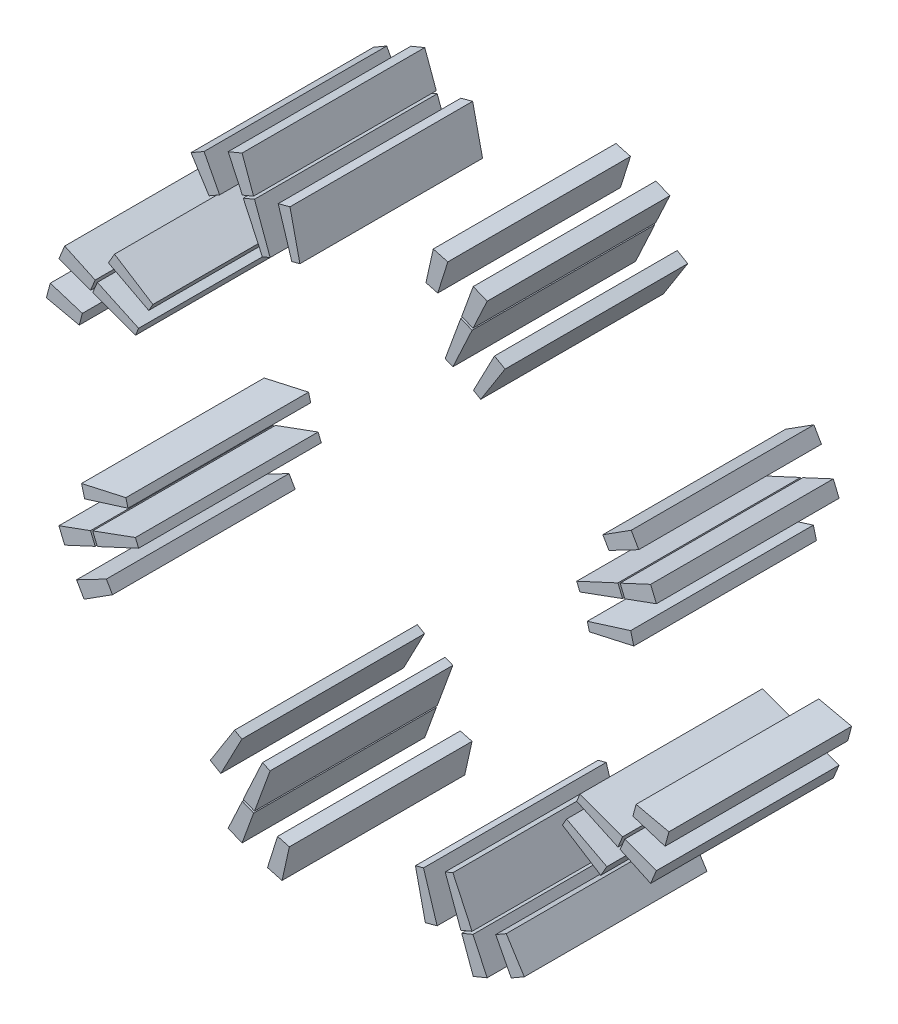
from build123d import *

# Parameters (mm, degrees)
SLOT_COPPER_ENVELOPES_START    = -15
SLOT_COPPER_ENVELOPES_DEPTH    = 30
SLOT_COPPER_ENVELOPES_2_DEPTH  = 30
SLOT_COPPER_ENVELOPES_3_DEPTH  = 30
SLOT_COPPER_ENVELOPES_4_DEPTH  = 30
SLOT_COPPER_ENVELOPES_5_DEPTH  = 30
SLOT_COPPER_ENVELOPES_6_DEPTH  = 30
SLOT_COPPER_ENVELOPES_7_DEPTH  = 30
SLOT_COPPER_ENVELOPES_8_DEPTH  = 30
SLOT_COPPER_ENVELOPES_9_DEPTH  = 30
SLOT_COPPER_ENVELOPES_10_DEPTH = 30
SLOT_COPPER_ENVELOPES_11_DEPTH = 30
SLOT_COPPER_ENVELOPES_12_DEPTH = 30
SLOT_COPPER_ENVELOPES_13_DEPTH = 30
SLOT_COPPER_ENVELOPES_14_DEPTH = 30
SLOT_COPPER_ENVELOPES_15_DEPTH = 30
SLOT_COPPER_ENVELOPES_16_DEPTH = 30
SLOT_COPPER_ENVELOPES_17_DEPTH = 30
SLOT_COPPER_ENVELOPES_18_DEPTH = 30
SLOT_COPPER_ENVELOPES_19_DEPTH = 30
SLOT_COPPER_ENVELOPES_20_DEPTH = 30
SLOT_COPPER_ENVELOPES_21_DEPTH = 30
SLOT_COPPER_ENVELOPES_22_DEPTH = 30
SLOT_COPPER_ENVELOPES_23_DEPTH = 30
SLOT_COPPER_ENVELOPES_24_DEPTH = 30
SLOT_COPPER_ENVELOPES_25_DEPTH = 30
SLOT_COPPER_ENVELOPES_26_DEPTH = 30
SLOT_COPPER_ENVELOPES_27_DEPTH = 30
SLOT_COPPER_ENVELOPES_28_DEPTH = 30
SLOT_COPPER_ENVELOPES_29_DEPTH = 30
SLOT_COPPER_ENVELOPES_30_DEPTH = 30
SLOT_COPPER_ENVELOPES_31_DEPTH = 30
SLOT_COPPER_ENVELOPES_32_DEPTH = 30


with BuildPart() as part:
    # Эскиз1 → Slot_copper_envelopes (new body)
    with BuildSketch(Plane.XY.offset(SLOT_COPPER_ENVELOPES_START)):
        Polygon((38.058700706, 9.486045745), (45.345480219, 11.114145895), (44.827410764, 13.047607424), (37.702824519, 10.814193756), align=None)
    extrude(amount=SLOT_COPPER_ENVELOPES_DEPTH)


with BuildPart() as body_2:
    # Эскиз1 → Slot_copper_envelopes 2 (new body)
    with BuildSketch(Plane.XY.offset(SLOT_COPPER_ENVELOPES_START)):
        Polygon((43.866578102, 17.086837391), (49.055420626, 18.979960184), (48.108279131, 21.266562026), (43.100573431, 18.936136255), align=None)
    extrude(amount=SLOT_COPPER_ENVELOPES_2_DEPTH)


with BuildPart() as body_3:
    # Эскиз1 → Slot_copper_envelopes 3 (new body)
    with BuildSketch(Plane.XY.offset(SLOT_COPPER_ENVELOPES_START)):
        Polygon((36.494925815, 14.372548593), (43.506856207, 16.937835703), (42.740851536, 18.787134567), (35.968736096, 15.64288295), align=None)
    extrude(amount=SLOT_COPPER_ENVELOPES_3_DEPTH)


with BuildPart() as body_4:
    # Эскиз1 → Slot_copper_envelopes 4 (new body)
    with BuildSketch(Plane.XY.offset(SLOT_COPPER_ENVELOPES_START)):
        Polygon((41.261013623, 22.666394534), (46.158362771, 25.220601255), (44.920862771, 27.364014129), (40.26018029, 24.399888717), align=None)
    extrude(amount=SLOT_COPPER_ENVELOPES_4_DEPTH)


with BuildPart() as body_5:
    # Эскиз1 → Slot_copper_envelopes 5 (new body)
    with BuildSketch(Plane.XY.offset(SLOT_COPPER_ENVELOPES_START)):
        Polygon((20.203918079, 33.619212625), (24.20520863, 39.922984488), (22.471714447, 40.923817822), (19.013133149, 34.306712625), align=None)
    extrude(amount=SLOT_COPPER_ENVELOPES_5_DEPTH)


with BuildPart() as body_6:
    # Эскиз1 → Slot_copper_envelopes 6 (new body)
    with BuildSketch(Plane.XY.offset(SLOT_COPPER_ENVELOPES_START)):
        Polygon((18.936136255, 43.100573431), (21.266562026, 48.108279131), (18.979960184, 49.055420626), (17.086837391, 43.866578102), align=None)
    extrude(amount=SLOT_COPPER_ENVELOPES_6_DEPTH)


with BuildPart() as body_7:
    # Эскиз1 → Slot_copper_envelopes 7 (new body)
    with BuildSketch(Plane.XY.offset(SLOT_COPPER_ENVELOPES_START)):
        Polygon((15.64288295, 35.968736096), (18.787134567, 42.740851536), (16.937835703, 43.506856207), (14.372548593, 36.494925815), align=None)
    extrude(amount=SLOT_COPPER_ENVELOPES_7_DEPTH)


with BuildPart() as body_8:
    # Эскиз1 → Slot_copper_envelopes 8 (new body)
    with BuildSketch(Plane.XY.offset(SLOT_COPPER_ENVELOPES_START)):
        Polygon((13.148381252, 45.203503812), (14.805233151, 50.472549497), (12.414566731, 51.113126634), (11.214919723, 45.721573267), align=None)
    extrude(amount=SLOT_COPPER_ENVELOPES_8_DEPTH)


with BuildPart() as body_9:
    # Эскиз1 → Slot_copper_envelopes 9 (new body)
    with BuildSketch(Plane.XY.offset(SLOT_COPPER_ENVELOPES_START)):
        Polygon((-9.486045745, 38.058700706), (-11.114145895, 45.345480219), (-13.047607424, 44.827410764), (-10.814193756, 37.702824519), align=None)
    extrude(amount=SLOT_COPPER_ENVELOPES_9_DEPTH)


with BuildPart() as body_10:
    # Эскиз1 → Slot_copper_envelopes 10 (new body)
    with BuildSketch(Plane.XY.offset(SLOT_COPPER_ENVELOPES_START)):
        Polygon((-17.086837391, 43.866578102), (-18.979960183, 49.055420626), (-21.266562026, 48.108279131), (-18.936136255, 43.100573431), align=None)
    extrude(amount=SLOT_COPPER_ENVELOPES_10_DEPTH)


with BuildPart() as body_11:
    # Эскиз1 → Slot_copper_envelopes 11 (new body)
    with BuildSketch(Plane.XY.offset(SLOT_COPPER_ENVELOPES_START)):
        Polygon((-14.372548593, 36.494925815), (-16.937835703, 43.506856207), (-18.787134567, 42.740851536), (-15.64288295, 35.968736096), align=None)
    extrude(amount=SLOT_COPPER_ENVELOPES_11_DEPTH)


with BuildPart() as body_12:
    # Эскиз1 → Slot_copper_envelopes 12 (new body)
    with BuildSketch(Plane.XY.offset(SLOT_COPPER_ENVELOPES_START)):
        Polygon((-22.666394534, 41.261013623), (-25.220601255, 46.158362771), (-27.364014129, 44.920862771), (-24.399888717, 40.26018029), align=None)
    extrude(amount=SLOT_COPPER_ENVELOPES_12_DEPTH)


with BuildPart() as body_13:
    # Эскиз1 → Slot_copper_envelopes 13 (new body)
    with BuildSketch(Plane.XY.offset(SLOT_COPPER_ENVELOPES_START)):
        Polygon((-33.619212625, 20.203918079), (-39.922984488, 24.20520863), (-40.923817822, 22.471714447), (-34.306712625, 19.013133149), align=None)
    extrude(amount=SLOT_COPPER_ENVELOPES_13_DEPTH)


with BuildPart() as body_14:
    # Эскиз1 → Slot_copper_envelopes 14 (new body)
    with BuildSketch(Plane.XY.offset(SLOT_COPPER_ENVELOPES_START)):
        Polygon((-43.100573431, 18.936136255), (-48.108279131, 21.266562026), (-49.055420626, 18.979960184), (-43.866578102, 17.086837391), align=None)
    extrude(amount=SLOT_COPPER_ENVELOPES_14_DEPTH)


with BuildPart() as body_15:
    # Эскиз1 → Slot_copper_envelopes 15 (new body)
    with BuildSketch(Plane.XY.offset(SLOT_COPPER_ENVELOPES_START)):
        Polygon((-35.968736096, 15.64288295), (-42.740851536, 18.787134567), (-43.506856207, 16.937835703), (-36.494925815, 14.372548593), align=None)
    extrude(amount=SLOT_COPPER_ENVELOPES_15_DEPTH)


with BuildPart() as body_16:
    # Эскиз1 → Slot_copper_envelopes 16 (new body)
    with BuildSketch(Plane.XY.offset(SLOT_COPPER_ENVELOPES_START)):
        Polygon((-45.203503812, 13.148381252), (-50.472549497, 14.805233151), (-51.113126634, 12.414566731), (-45.721573267, 11.214919723), align=None)
    extrude(amount=SLOT_COPPER_ENVELOPES_16_DEPTH)


with BuildPart() as body_17:
    # Эскиз1 → Slot_copper_envelopes 17 (new body)
    with BuildSketch(Plane.XY.offset(SLOT_COPPER_ENVELOPES_START)):
        Polygon((-38.058700706, -9.486045745), (-45.345480219, -11.114145895), (-44.827410764, -13.047607424), (-37.702824519, -10.814193756), align=None)
    extrude(amount=SLOT_COPPER_ENVELOPES_17_DEPTH)


with BuildPart() as body_18:
    # Эскиз1 → Slot_copper_envelopes 18 (new body)
    with BuildSketch(Plane.XY.offset(SLOT_COPPER_ENVELOPES_START)):
        Polygon((-43.866578102, -17.086837391), (-49.055420626, -18.979960184), (-48.108279131, -21.266562026), (-43.100573431, -18.936136255), align=None)
    extrude(amount=SLOT_COPPER_ENVELOPES_18_DEPTH)


with BuildPart() as body_19:
    # Эскиз1 → Slot_copper_envelopes 19 (new body)
    with BuildSketch(Plane.XY.offset(SLOT_COPPER_ENVELOPES_START)):
        Polygon((-36.494925815, -14.372548593), (-43.506856207, -16.937835703), (-42.740851536, -18.787134567), (-35.968736096, -15.64288295), align=None)
    extrude(amount=SLOT_COPPER_ENVELOPES_19_DEPTH)


with BuildPart() as body_20:
    # Эскиз1 → Slot_copper_envelopes 20 (new body)
    with BuildSketch(Plane.XY.offset(SLOT_COPPER_ENVELOPES_START)):
        Polygon((-41.261013623, -22.666394534), (-46.158362771, -25.220601255), (-44.920862771, -27.364014129), (-40.26018029, -24.399888717), align=None)
    extrude(amount=SLOT_COPPER_ENVELOPES_20_DEPTH)


with BuildPart() as body_21:
    # Эскиз1 → Slot_copper_envelopes 21 (new body)
    with BuildSketch(Plane.XY.offset(SLOT_COPPER_ENVELOPES_START)):
        Polygon((-20.203918079, -33.619212625), (-24.20520863, -39.922984488), (-22.471714447, -40.923817822), (-19.013133149, -34.306712625), align=None)
    extrude(amount=SLOT_COPPER_ENVELOPES_21_DEPTH)


with BuildPart() as body_22:
    # Эскиз1 → Slot_copper_envelopes 22 (new body)
    with BuildSketch(Plane.XY.offset(SLOT_COPPER_ENVELOPES_START)):
        Polygon((-18.936136255, -43.100573431), (-21.266562026, -48.108279131), (-18.979960183, -49.055420626), (-17.086837391, -43.866578102), align=None)
    extrude(amount=SLOT_COPPER_ENVELOPES_22_DEPTH)


with BuildPart() as body_23:
    # Эскиз1 → Slot_copper_envelopes 23 (new body)
    with BuildSketch(Plane.XY.offset(SLOT_COPPER_ENVELOPES_START)):
        Polygon((-15.64288295, -35.968736096), (-18.787134567, -42.740851536), (-16.937835703, -43.506856207), (-14.372548593, -36.494925815), align=None)
    extrude(amount=SLOT_COPPER_ENVELOPES_23_DEPTH)


with BuildPart() as body_24:
    # Эскиз1 → Slot_copper_envelopes 24 (new body)
    with BuildSketch(Plane.XY.offset(SLOT_COPPER_ENVELOPES_START)):
        Polygon((-13.148381252, -45.203503812), (-14.805233151, -50.472549497), (-12.414566731, -51.113126634), (-11.214919723, -45.721573267), align=None)
    extrude(amount=SLOT_COPPER_ENVELOPES_24_DEPTH)


with BuildPart() as body_25:
    # Эскиз1 → Slot_copper_envelopes 25 (new body)
    with BuildSketch(Plane.XY.offset(SLOT_COPPER_ENVELOPES_START)):
        Polygon((9.486045745, -38.058700706), (11.114145895, -45.345480219), (13.047607424, -44.827410764), (10.814193756, -37.702824519), align=None)
    extrude(amount=SLOT_COPPER_ENVELOPES_25_DEPTH)


with BuildPart() as body_26:
    # Эскиз1 → Slot_copper_envelopes 26 (new body)
    with BuildSketch(Plane.XY.offset(SLOT_COPPER_ENVELOPES_START)):
        Polygon((17.086837391, -43.866578102), (18.979960183, -49.055420626), (21.266562026, -48.108279131), (18.936136255, -43.100573431), align=None)
    extrude(amount=SLOT_COPPER_ENVELOPES_26_DEPTH)


with BuildPart() as body_27:
    # Эскиз1 → Slot_copper_envelopes 27 (new body)
    with BuildSketch(Plane.XY.offset(SLOT_COPPER_ENVELOPES_START)):
        Polygon((14.372548593, -36.494925815), (16.937835703, -43.506856207), (18.787134567, -42.740851536), (15.64288295, -35.968736096), align=None)
    extrude(amount=SLOT_COPPER_ENVELOPES_27_DEPTH)


with BuildPart() as body_28:
    # Эскиз1 → Slot_copper_envelopes 28 (new body)
    with BuildSketch(Plane.XY.offset(SLOT_COPPER_ENVELOPES_START)):
        Polygon((22.666394534, -41.261013623), (25.220601255, -46.158362771), (27.364014129, -44.920862771), (24.399888717, -40.26018029), align=None)
    extrude(amount=SLOT_COPPER_ENVELOPES_28_DEPTH)


with BuildPart() as body_29:
    # Эскиз1 → Slot_copper_envelopes 29 (new body)
    with BuildSketch(Plane.XY.offset(SLOT_COPPER_ENVELOPES_START)):
        Polygon((33.619212625, -20.203918079), (39.922984488, -24.20520863), (40.923817822, -22.471714447), (34.306712625, -19.013133149), align=None)
    extrude(amount=SLOT_COPPER_ENVELOPES_29_DEPTH)


with BuildPart() as body_30:
    # Эскиз1 → Slot_copper_envelopes 30 (new body)
    with BuildSketch(Plane.XY.offset(SLOT_COPPER_ENVELOPES_START)):
        Polygon((43.100573431, -18.936136255), (48.108279131, -21.266562026), (49.055420626, -18.979960183), (43.866578102, -17.086837391), align=None)
    extrude(amount=SLOT_COPPER_ENVELOPES_30_DEPTH)


with BuildPart() as body_31:
    # Эскиз1 → Slot_copper_envelopes 31 (new body)
    with BuildSketch(Plane.XY.offset(SLOT_COPPER_ENVELOPES_START)):
        Polygon((35.968736096, -15.64288295), (42.740851536, -18.787134567), (43.506856207, -16.937835703), (36.494925815, -14.372548593), align=None)
    extrude(amount=SLOT_COPPER_ENVELOPES_31_DEPTH)


with BuildPart() as body_32:
    # Эскиз1 → Slot_copper_envelopes 32 (new body)
    with BuildSketch(Plane.XY.offset(SLOT_COPPER_ENVELOPES_START)):
        Polygon((45.203503812, -13.148381252), (50.472549497, -14.805233151), (51.113126634, -12.414566731), (45.721573267, -11.214919723), align=None)
    extrude(amount=SLOT_COPPER_ENVELOPES_32_DEPTH)


solid = Compound([part.part, body_2.part, body_3.part, body_4.part, body_5.part, body_6.part, body_7.part, body_8.part, body_9.part, body_10.part, body_11.part, body_12.part, body_13.part, body_14.part, body_15.part, body_16.part, body_17.part, body_18.part, body_19.part, body_20.part, body_21.part, body_22.part, body_23.part, body_24.part, body_25.part, body_26.part, body_27.part, body_28.part, body_29.part, body_30.part, body_31.part, body_32.part])
